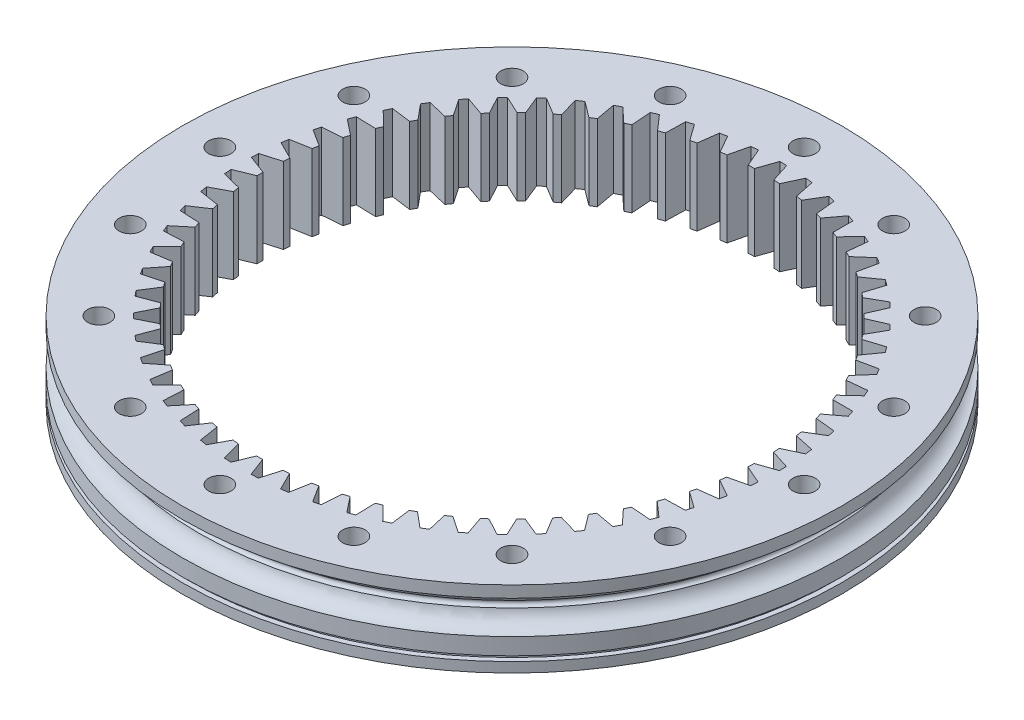
from build123d import *

# Parameters (mm, degrees)
ESQUISSE4_R                  = 6.75
ENL_V_MAT_EXTRU_2_DEPTH      = 285.465287865
ENL_V_MAT_EXTRU_3_DEPTH      = 285.465287865
R_P_TITION_CIRCULAIRE1_COUNT = 61


with BuildPart() as part:
    # Esquisse1 → Révolution1 (revolve)
    with BuildSketch(Plane.XY):
        with BuildLine():
            Line((-198.5, 30), (-198.5, 37))
            Line((-198.5, 37), (-150, 37))
            Line((-150, 37), (-150, -9))
            Line((-150, -9), (-198.5, -9))
            Line((-198.5, -9), (-198.5, -3))
            Line((-198.5, -3), (-195.5, -3))
            Line((-195.5, -3), (-195.5, 0))
            Line((-195.5, 0), (-198.5, 0))
            Line((-198.5, 0), (-198.5, 10))
            ThreePointArc((-198.5, 10), (-192.166348189, 12.261469472), (-188.697368421, 18.023029052))
            ThreePointArc((-188.697368421, 18.023029052), (-187, 20), (-188.697368421, 21.976970948))
            ThreePointArc((-188.697368421, 21.976970948), (-192.166348189, 27.738530528), (-198.5, 30))
        make_face()
    revolve(axis=Axis((0, 46, 0), (0, -1, 0)))

    # Esquisse4 → Enlèv. mat.-Extru.2 (cut, through all)
    with BuildSketch(Plane(origin=(0, 37, 0), x_dir=(1, 0, 0), z_dir=(0, 1, 0))):
        with Locations((-176, 0)):
            Circle(ESQUISSE4_R)
        with Locations((-162.602797722, 67.352284096)):
            Circle(ESQUISSE4_R)
        with Locations((-124.450793489, 124.450793489)):
            Circle(ESQUISSE4_R)
        with Locations((-67.352284096, 162.602797722)):
            Circle(ESQUISSE4_R)
        with Locations((0, 176)):
            Circle(ESQUISSE4_R)
        with Locations((67.352284096, 162.602797722)):
            Circle(ESQUISSE4_R)
        with Locations((124.450793489, 124.450793489)):
            Circle(ESQUISSE4_R)
        with Locations((162.602797722, 67.352284096)):
            Circle(ESQUISSE4_R)
        with Locations((176, 0)):
            Circle(ESQUISSE4_R)
        with Locations((162.602797722, -67.352284096)):
            Circle(ESQUISSE4_R)
        with Locations((124.450793489, -124.450793489)):
            Circle(ESQUISSE4_R)
        with Locations((67.352284096, -162.602797722)):
            Circle(ESQUISSE4_R)
        with Locations((0, -176)):
            Circle(ESQUISSE4_R)
        with Locations((-67.352284096, -162.602797722)):
            Circle(ESQUISSE4_R)
        with Locations((-124.450793489, -124.450793489)):
            Circle(ESQUISSE4_R)
        with Locations((-162.602797722, -67.352284096)):
            Circle(ESQUISSE4_R)
    extrude(amount=-ENL_V_MAT_EXTRU_2_DEPTH, mode=Mode.SUBTRACT)

    # Esquisse5 → Enlèv. mat.-Extru.3 (cut, through all)
    with BuildSketch(Plane(origin=(0, 37, 0), x_dir=(1, 0, 0), z_dir=(0, 1, 0))):
        Polygon((-144.492676621, 15.186792278), (-149.178284305, 15.67926949), (-149.53760006, 11.768864359), (-161.029012479, 8.439172944), (-161.194743652, 4.221032915), (-150, 0), (-144.492676621, 0), align=None)
    enl_v_mat_extru_3 = extrude(amount=-ENL_V_MAT_EXTRU_3_DEPTH, mode=Mode.SUBTRACT)

    # Répétition circulaire1: Enlèv. mat.-Extru.3 ×61 about axis
    r_p_tition_circulaire1_axis = Axis((0, 39.3, 0), (0, -1, 0))
    for i in range(1, R_P_TITION_CIRCULAIRE1_COUNT):
        add(enl_v_mat_extru_3.rotate(r_p_tition_circulaire1_axis, i * 360 / R_P_TITION_CIRCULAIRE1_COUNT), mode=Mode.SUBTRACT)


solid = part.part
